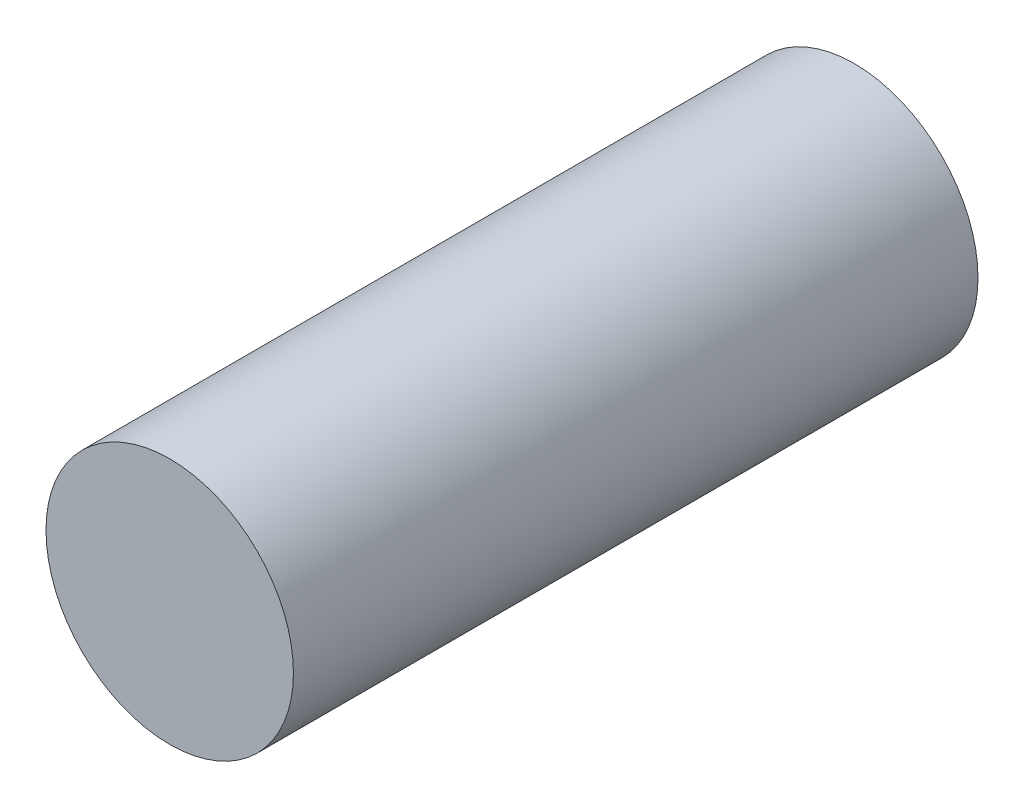
from build123d import *

# Parameters (mm, degrees)
CROQUIS1_R              = 7.5
SALIENTE_EXTRUIR1_DEPTH = 41.5


with BuildPart() as part:
    # Croquis1 → Saliente-Extruir1 (new body)
    with BuildSketch(Plane.XY):
        Circle(CROQUIS1_R)
    extrude(amount=SALIENTE_EXTRUIR1_DEPTH)


solid = part.part
